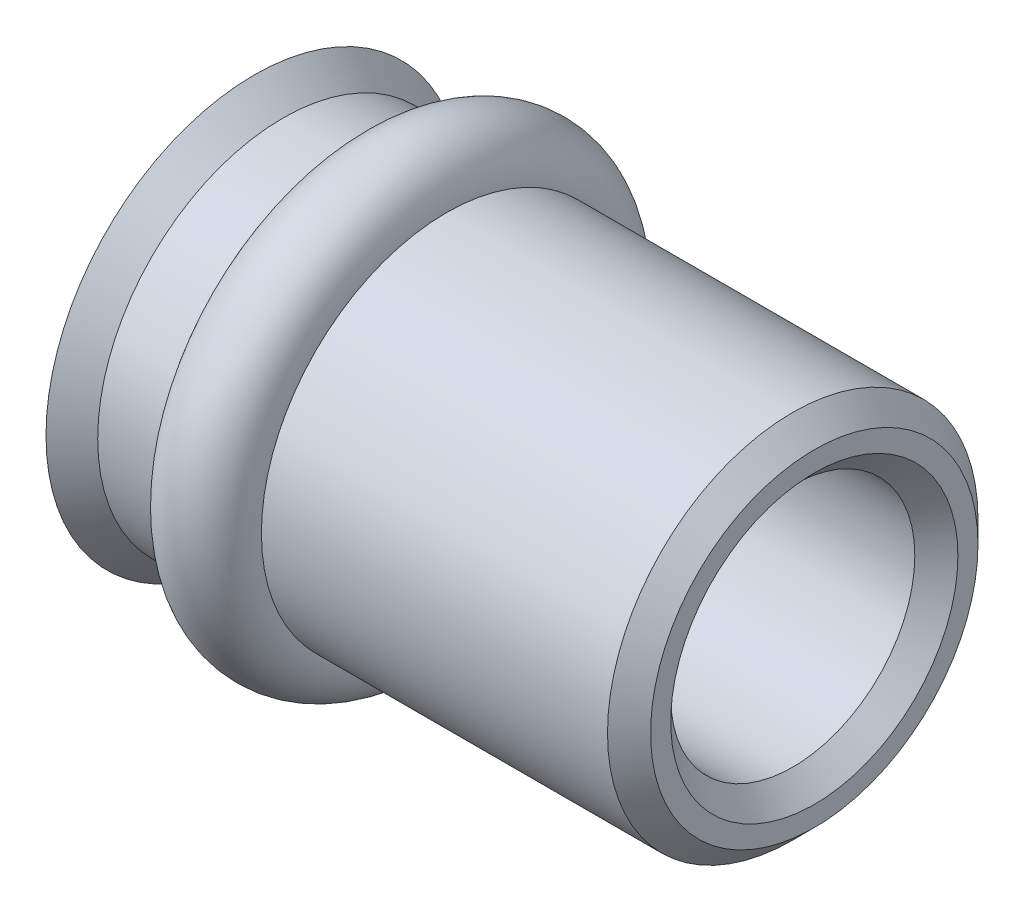
from build123d import *


with BuildPart() as part:
    # Эскиз1 → Повернуть1 (revolve)
    with BuildSketch(Plane.XY, mode=Mode.PRIVATE) as revolve_1_sk:
        with BuildLine():
            Line((0, 7.25), (0, 5.25))
            Line((0, 5.25), (9, 5.25))
            Line((9, 5.25), (10, 4.25))
            Line((10, 4.25), (18.75, 4.25))
            Line((18.75, 4.25), (19.5, 5))
            Line((19.5, 5), (19.5, 5.7))
            Line((19.5, 5.7), (18.75, 6.45))
            Line((18.75, 6.45), (6.7, 6.45))
            ThreePointArc((6.7, 6.45), (5.1, 8.05), (3.5, 6.45))
            Line((3.5, 6.45), (1, 6.45))
            Line((1, 6.45), (0, 7.25))
        make_face()
    revolve(revolve_1_sk.sketch.rotate(Axis((0, 0, 0), (-1, 0, 0)), 90), axis=Axis((0, 0, 0), (-1, 0, 0)))


solid = part.part
